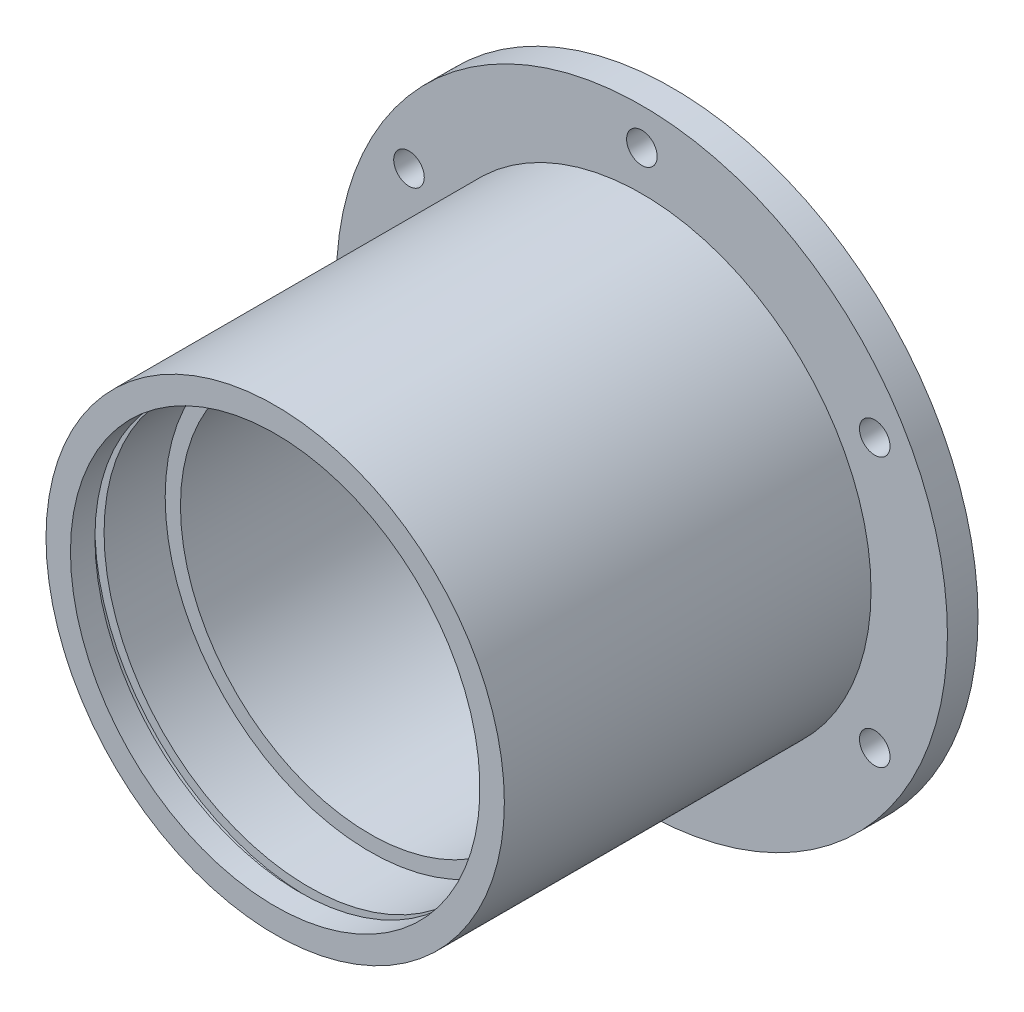
from build123d import *

# Parameters (mm, degrees)
SKETCH1_R                = 50
SKETCH1_R_2              = 2.5
BOSS_EXTRUDE1_DEPTH      = 5
SKETCH2_R                = 37.5
SKETCH2_R_2              = 33.5
BOSS_EXTRUDE2_DEPTH      = 60
SKETCH3_R                = 33.5
CUT_EXTRUDE1_DEPTH       = 50
BOSS_EXTRUDE4_DEPTH      = 17
BOSS_EXTRUDE4_DEPTH_BACK = 17
SKETCH5_R                = 35
SKETCH5_R_2              = 31
CUT_EXTRUDE2_START       = 10
SKETCH6_R                = 34.5
CUT_EXTRUDE2_DEPTH       = 1.5
CUT_EXTRUDE3_START       = 10
SKETCH7_R                = 35
CUT_EXTRUDE3_DEPTH       = 1.5


with BuildPart() as part:
    # Sketch1 → Boss-Extrude1 (new body)
    with BuildSketch(Plane.XY):
        Circle(SKETCH1_R)
        with Locations((0, 44)):
            Circle(SKETCH1_R_2, mode=Mode.SUBTRACT)
        with Locations((38.105117767, 22)):
            Circle(SKETCH1_R_2, mode=Mode.SUBTRACT)
        with Locations((38.105117767, -22)):
            Circle(SKETCH1_R_2, mode=Mode.SUBTRACT)
        with Locations((0, -44)):
            Circle(SKETCH1_R_2, mode=Mode.SUBTRACT)
        with Locations((-38.105117767, -22)):
            Circle(SKETCH1_R_2, mode=Mode.SUBTRACT)
        with Locations((-38.105117767, 22)):
            Circle(SKETCH1_R_2, mode=Mode.SUBTRACT)
    extrude(amount=BOSS_EXTRUDE1_DEPTH)

    # Sketch2 → Boss-Extrude2 (add)
    with BuildSketch(Plane.XY.offset(5)):
        with Locations(Location((0, 0, 0), (0, 0, 180))):
            Circle(SKETCH2_R)
        with Locations(Location((0, 0, 0), (0, 0, 180))):
            Circle(SKETCH2_R_2, mode=Mode.SUBTRACT)
    extrude(amount=BOSS_EXTRUDE2_DEPTH)

    # Sketch3 → Cut-Extrude1 (cut)
    with BuildSketch(Plane(origin=(0, 0, 0), x_dir=(-1, 0, 0), z_dir=(0, 0, -1))):
        Circle(SKETCH3_R)
    extrude(amount=-CUT_EXTRUDE1_DEPTH, mode=Mode.SUBTRACT)

    # Sketch5 → Boss-Extrude4 (add, two sides: drawn at the far end of the back side and taken through both)
    with BuildSketch(Plane(origin=(0, 0, 32.5), x_dir=(-1, 0, 0), z_dir=(0, 0, -1)).offset(-BOSS_EXTRUDE4_DEPTH_BACK)):
        Circle(SKETCH5_R)
        Circle(SKETCH5_R_2, mode=Mode.SUBTRACT)
    extrude(amount=BOSS_EXTRUDE4_DEPTH + BOSS_EXTRUDE4_DEPTH_BACK)

    # Sketch6 → Cut-Extrude2 (cut)
    with BuildSketch(Plane(origin=(0, 0, 15.5), x_dir=(-1, 0, 0), z_dir=(0, 0, -1)).offset(CUT_EXTRUDE2_START)):
        with Locations(Location((0, 0, 0), (0, 0, 180))):
            Circle(SKETCH6_R)
    extrude(amount=CUT_EXTRUDE2_DEPTH, mode=Mode.SUBTRACT)

    # Sketch7 → Cut-Extrude3 (cut)
    with BuildSketch(Plane.XY.offset(49.5).offset(CUT_EXTRUDE3_START)):
        Circle(SKETCH7_R)
    extrude(amount=CUT_EXTRUDE3_DEPTH, mode=Mode.SUBTRACT)


solid = part.part
